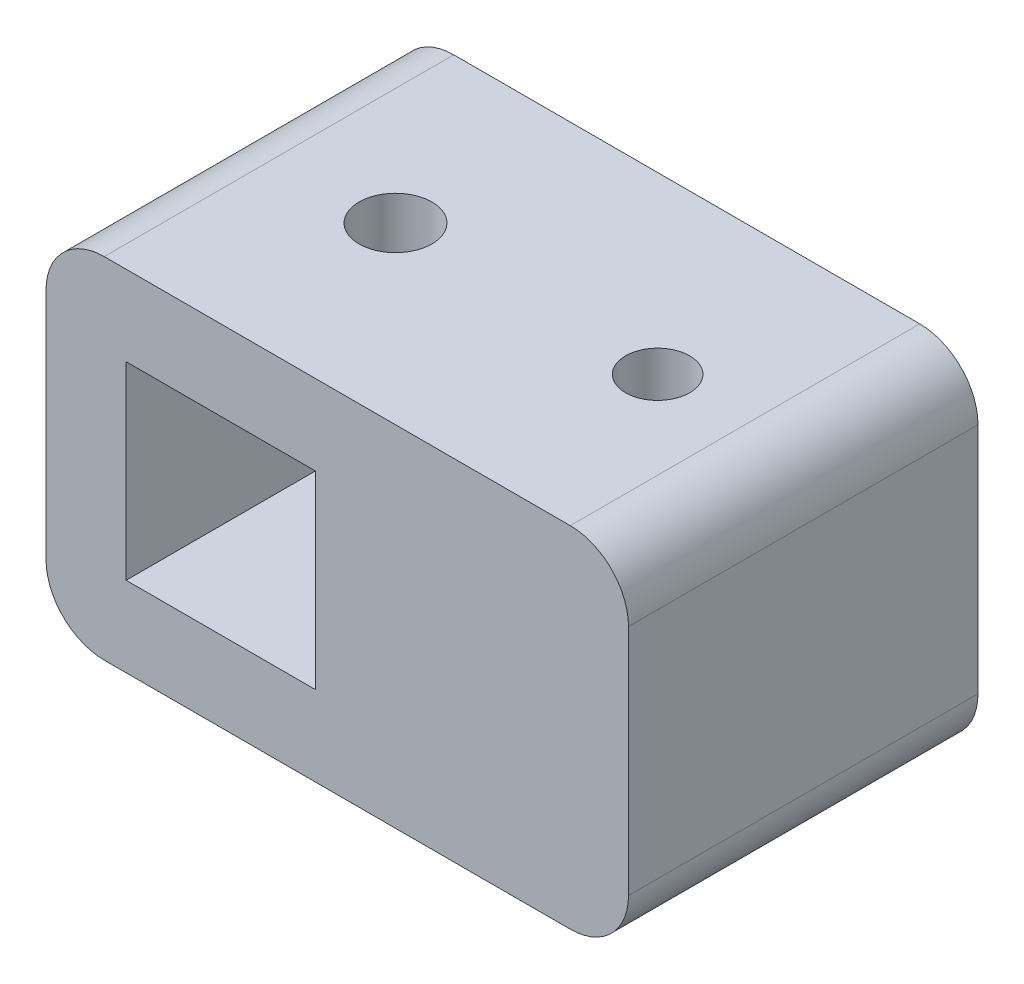
from build123d import *

# Parameters (mm, degrees)
SKETCH1_R               = 4.5
SKETCH1_R_2             = 1.25
BOSS_EXTRUDE1_DEPTH     = 8
SKETCH2_R               = 1.75
SKETCH2_R_2             = 1.25
CUT_EXTRUDE1_DEPTH      = 4
SKETCH4_W               = 12
SKETCH4_H               = 12
SKETCH4_W_2             = 6.5
SKETCH4_H_2             = 6.5
BOSS_EXTRUDE2_DEPTH     = 12
SKETCH5_W               = 12
SKETCH5_H               = 12
BOSS_EXTRUDE3_DEPTH     = 8
CUT_EXTRUDE2_DEPTH      = 23
CUT_EXTRUDE2_DEPTH_BACK = 23
SKETCH6_R               = 1.1
FILLET1_R               = 2
SKETCH1_2_R             = 4.5
SKETCH1_2_R_2           = 1.25
CUT_EXTRUDE5_DEPTH      = 8
CUT_EXTRUDE6_DEPTH      = 13


with BuildPart() as part:
    # Sketch1 → Boss-Extrude1 (new body)
    with BuildSketch(Plane.XY):
        Circle(SKETCH1_R)
        Circle(SKETCH1_R_2, mode=Mode.SUBTRACT)
    extrude(amount=BOSS_EXTRUDE1_DEPTH)

    # Sketch2 → Cut-Extrude1 (cut)
    with BuildSketch(Plane(origin=(0, 0, 0), x_dir=(-1, 0, 0), z_dir=(0, 0, -1))):
        Circle(SKETCH2_R)
        Circle(SKETCH2_R_2, mode=Mode.SUBTRACT)
    extrude(amount=-CUT_EXTRUDE1_DEPTH, mode=Mode.SUBTRACT)

    # Sketch4 → Boss-Extrude2 (add)
    with BuildSketch(Plane(origin=(0, 0, 0), x_dir=(-1, 0, 0), z_dir=(0, 0, -1))):
        Rectangle(SKETCH4_W, SKETCH4_H)
        Rectangle(SKETCH4_W_2, SKETCH4_H_2, mode=Mode.SUBTRACT)
    extrude(amount=BOSS_EXTRUDE2_DEPTH)

    # Sketch5 → Boss-Extrude3 (add)
    with BuildSketch(Plane(origin=(6, 0, 0), x_dir=(0, 0, -1), z_dir=(1, 0, 0))):
        with Locations((6, 0)):
            Rectangle(SKETCH5_W, SKETCH5_H)
    extrude(amount=BOSS_EXTRUDE3_DEPTH)

    # Sketch6 → Cut-Extrude2 (cut, two sides: drawn at the far end of the back side and taken through both)
    with BuildSketch(Plane(origin=(0, 6, 0), x_dir=(1, 0, 0), z_dir=(0, 1, 0)).offset(-CUT_EXTRUDE2_DEPTH_BACK)):
        with Locations(Location((9, 6, 0), (0, 0, 270))):
            Circle(SKETCH6_R)
    extrude(amount=CUT_EXTRUDE2_DEPTH + CUT_EXTRUDE2_DEPTH_BACK, mode=Mode.SUBTRACT)

    # Fillet1
    fillet1_edges = [part.edges().sort_by_distance(p)[0] for p in [
        (-6, -6, -6),
        (-6, 6, -6),
        (14, 6, -6),
        (14, -6, -6),
    ]]
    fillet(fillet1_edges, radius=FILLET1_R)

    # Sketch1<2> → Cut-Extrude5 (cut)
    with BuildSketch(Plane.XY):
        Circle(SKETCH1_2_R)
        Circle(SKETCH1_2_R_2, mode=Mode.SUBTRACT)
    extrude(amount=CUT_EXTRUDE5_DEPTH, mode=Mode.SUBTRACT)

    # Sketch7 → Cut-Extrude6 (cut)
    with BuildSketch(Plane(origin=(0, 6, 0), x_dir=(1, 0, 0), z_dir=(0, 1, 0))):
        with BuildLine():
            ThreePointArc((-1.25, 6), (0, 4.75), (1.25, 6))
            Line((1.25, 6), (-1.25, 6))
        make_face()
        with BuildLine():
            Line((-1.25, 6), (1.25, 6))
            ThreePointArc((1.25, 6), (0, 7.25), (-1.25, 6))
        make_face()
    extrude(amount=-CUT_EXTRUDE6_DEPTH, mode=Mode.SUBTRACT)


solid = part.part
